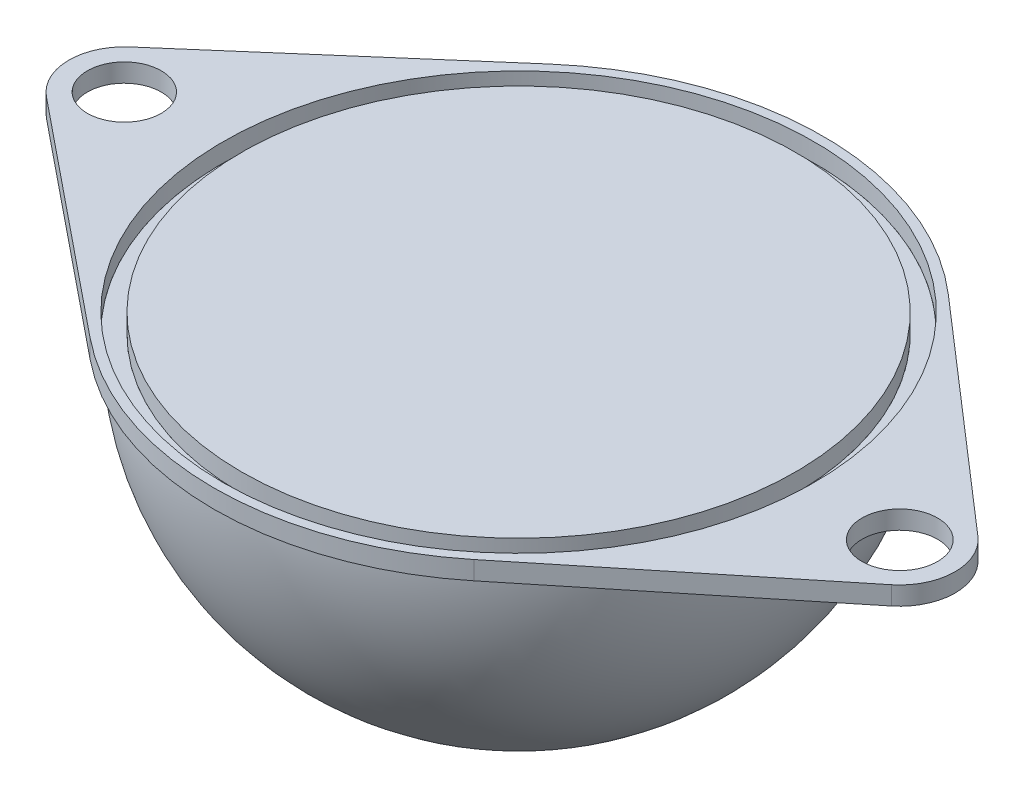
from build123d import *

# Parameters (mm, degrees)
REVOLVE6_ANGLE          = 180
SKETCH1_9_R             = 2
BOSS_EXTRUDE1_DEPTH     = 1
SKETCH1_9_R_2           = 15
BOSS_EXTRUDE1_2_DEPTH   = 1
CUT_EXTRUDE1_REACH      = 35.231
CUT_EXTRUDE1_END_RADIUS = 16
SKETCH2_R               = 7.5


with BuildPart() as part:
    # Sketch1 → Revolve6 (revolve)
    with BuildSketch(Plane(origin=(0, 0, 0), x_dir=(1, 0, 0), z_dir=(0, 1, 0))):
        with BuildLine():
            ThreePointArc((-16, 0), (0, -16), (16, 0))
            Line((16, 0), (15, 0))
            ThreePointArc((15, 0), (0, -15), (-15, 0))
            Line((-15, 0), (-16, 0))
        make_face()
    revolve(axis=Axis((-19.031531421, 0, 0), (1, 0, 0)), revolution_arc=REVOLVE6_ANGLE)

    # Cut-Extrude1: up to this sphere (the profile starts inside it)
    cut_extrude1_end = Location((0, 0, 0)) * Sphere(CUT_EXTRUDE1_END_RADIUS, mode=Mode.PRIVATE)
    # Sketch2 → Cut-Extrude1 (cut, up to the surface)
    with BuildSketch(Plane(origin=(0, 0, 0), x_dir=(1, 0, 0), z_dir=(0, 1, 0)), mode=Mode.PRIVATE) as cut_extrude1_sk1:
        Circle(SKETCH2_R)
    cut_extrude1_tool1 = extrude(cut_extrude1_sk1.sketch, amount=-CUT_EXTRUDE1_REACH, mode=Mode.PRIVATE) & cut_extrude1_end
    add(cut_extrude1_tool1.solids().sort_by_distance((0, 0, 0))[0], mode=Mode.SUBTRACT)


with BuildPart() as body_2:
    # Sketch1<9> → Boss-Extrude1 (new body)
    with BuildSketch(Plane(origin=(0, 0, 0), x_dir=(1, 0, 0), z_dir=(0, 1, 0))):
        with BuildLine():
            ThreePointArc((-22.96695029, 1.912018961), (-24, -0.404273426), (-22.889523883, -2.684458707))
            Line((-22.889523883, -2.684458707), (-10.390907276, -12.81713876))
            ThreePointArc((-10.390907276, -12.81713876), (0, -16.5), (10.390907276, -12.81713876))
            Line((10.390907276, -12.81713876), (22.889523883, -2.684458707))
            ThreePointArc((22.889523883, -2.684458707), (23.780005188, -1.48251064), (23.979500335, 0))
            ThreePointArc((23.979500335, 0), (23.651565118, 1.050453093), (22.96695029, 1.912018961))
            Line((22.96695029, 1.912018961), (10.816692113, 12.459902557))
            ThreePointArc((10.816692113, 12.459902557), (0, 16.5), (-10.816692113, 12.459902557))
            Line((-10.816692113, 12.459902557), (-22.96695029, 1.912018961))
        make_face()
        with Locations((-21, -0.353739248)):
            Circle(SKETCH1_9_R, mode=Mode.SUBTRACT)
        with BuildLine():
            ThreePointArc((18.984689587, 0), (21, 1.692380865), (23.015310413, 0))
            ThreePointArc((23.015310413, 0), (21, -2.39985936), (18.984689587, 0))
        make_face(mode=Mode.SUBTRACT)
        with BuildLine():
            ThreePointArc((-16, 0), (0, 16), (16, 0))
            ThreePointArc((16, 0), (0, -16), (-16, 0))
        make_face(mode=Mode.SUBTRACT)
    extrude(amount=BOSS_EXTRUDE1_DEPTH)


with BuildPart() as body_3:
    # Sketch1<9> → Boss-Extrude1 2 (new body)
    with BuildSketch(Plane(origin=(0, 0, 0), x_dir=(1, 0, 0), z_dir=(0, 1, 0))):
        Circle(SKETCH1_9_R_2)
    extrude(amount=BOSS_EXTRUDE1_2_DEPTH)


solid = Compound([part.part, body_2.part, body_3.part])
